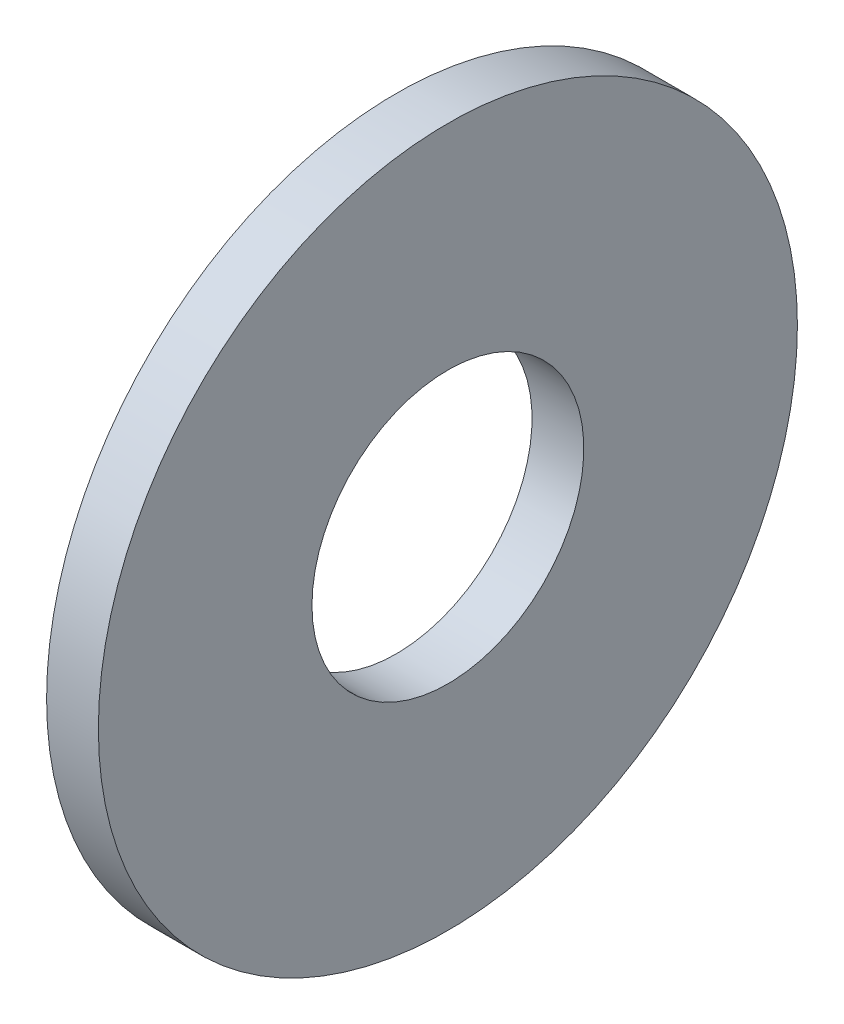
from build123d import *

# Parameters (mm, degrees)
ESQUISSE1_W = 2
ESQUISSE1_H = 8.25


with BuildPart() as part:
    # Esquisse1 → Base-Révolution (revolve)
    with BuildSketch(Plane(origin=(0, 0, 0), x_dir=(1, 0, 0), z_dir=(0, 1, 0))):
        with Locations((1, 9.375)):
            Rectangle(ESQUISSE1_W, ESQUISSE1_H)
    revolve(axis=Axis((0, 0, 0), (1, 0, 0)))


solid = part.part
